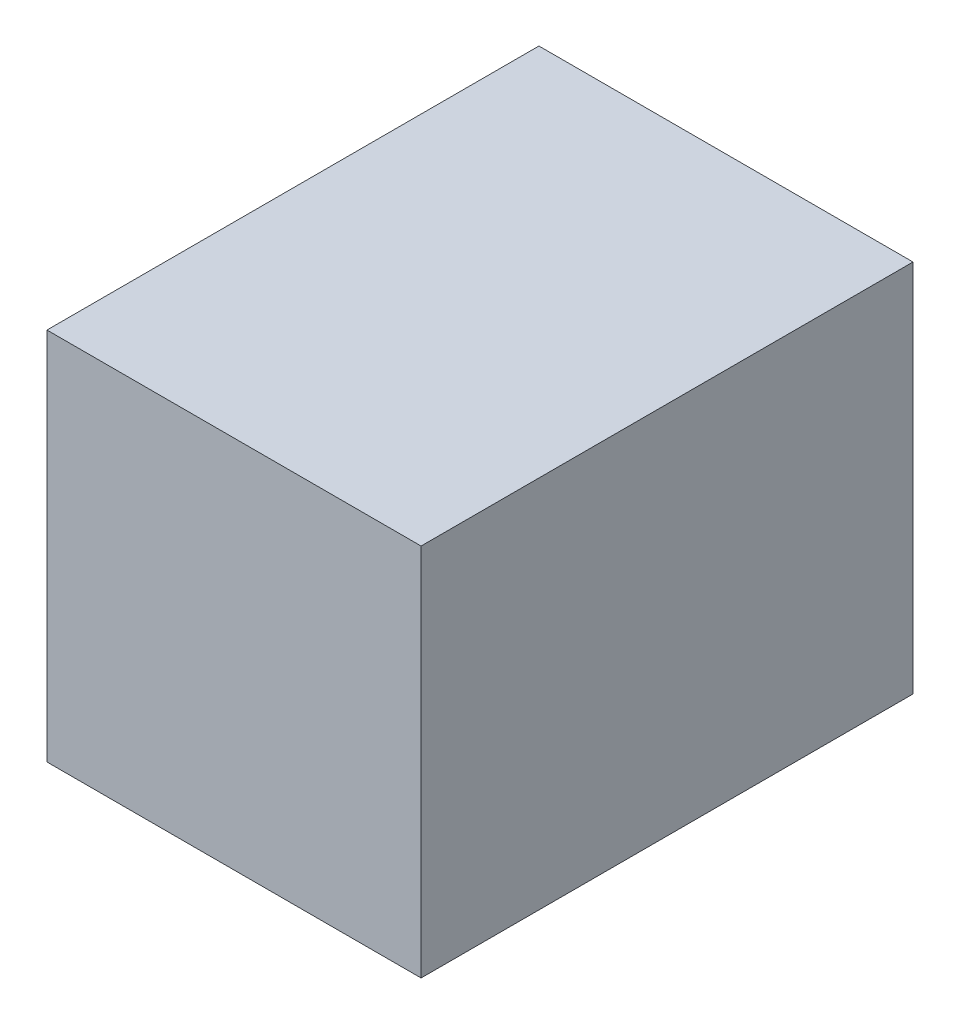
from build123d import *

# Parameters (mm, degrees)
SKETCH1_W           = 10
SKETCH1_H           = 13.15
BOSS_EXTRUDE1_DEPTH = 10


with BuildPart() as part:
    # Sketch1 → Boss-Extrude1 (new body)
    with BuildSketch(Plane(origin=(0, 0, 0), x_dir=(1, 0, 0), z_dir=(0, 1, 0))):
        Rectangle(SKETCH1_W, SKETCH1_H)
    extrude(amount=BOSS_EXTRUDE1_DEPTH)


solid = part.part
